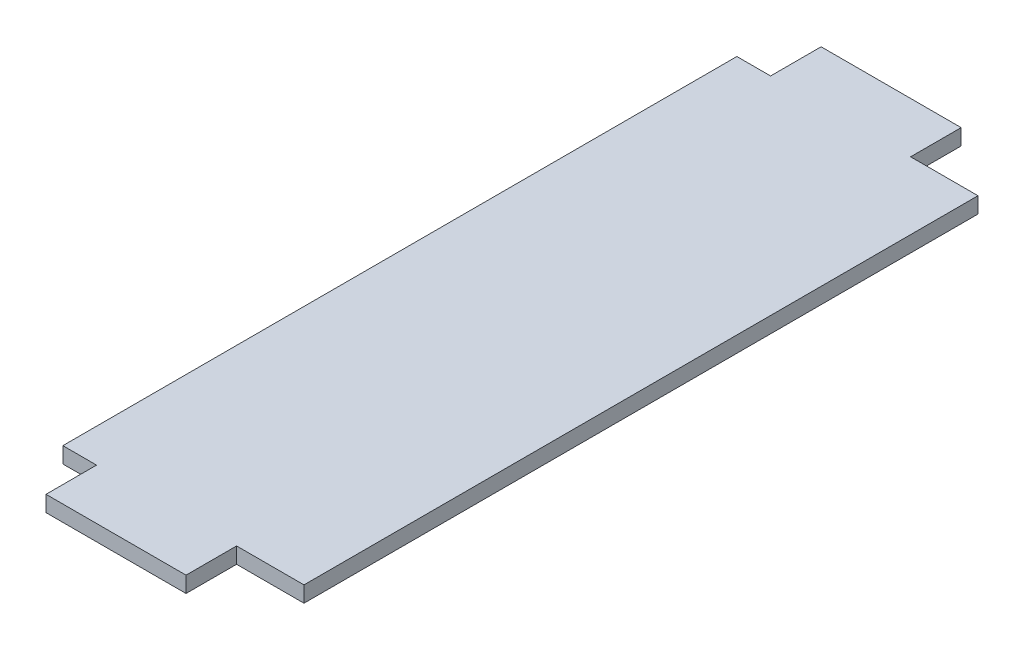
from build123d import *

# Parameters (mm, degrees)
BOSS_EXTRUDE1_DEPTH = 2.9972


with BuildPart() as part:
    # Sketch1 → Boss-Extrude1 (new body)
    with BuildSketch(Plane(origin=(0, 0, 0), x_dir=(1, 0, 0), z_dir=(0, 1, 0))):
        Polygon((-16.3668456, -73.025), (10.0168456, -73.025), (10.0168456, -63.5), (22.7168456, -63.5), (22.7168456, 63.5), (10.0168456, 63.5), (10.0168456, 73.025), (-16.3668456, 73.025), (-16.3668456, 63.5), (-22.7168456, 63.5), (-22.7168456, -63.5), (-16.3668456, -63.5), align=None)
    extrude(amount=BOSS_EXTRUDE1_DEPTH)


solid = part.part
